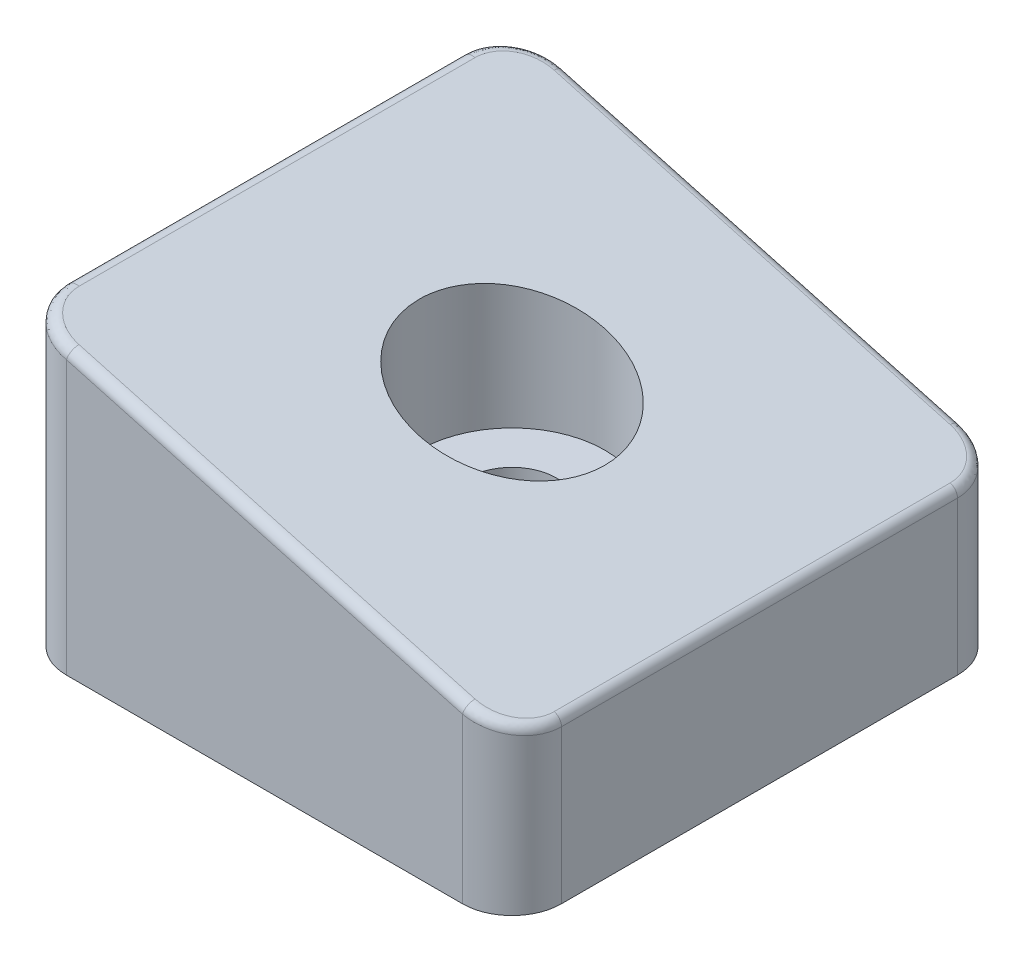
from build123d import *

# Parameters (mm, degrees)
BOSS_EXTRUDE1_DEPTH = 25.4
CUT_EXTRUDE1_DEPTH  = 44.994090512
CUT_EXTRUDE2_DEPTH  = 19.05
FILLET1_R           = 2.54
FILLET2_R           = 0.508


with BuildPart() as part:
    # Sketch1 → Boss-Extrude1 (new body)
    with BuildSketch(Plane.XY):
        Polygon((0, 27.94), (0, 12.7), (25.4, 12.7), (25.4, 20.955), align=None)
    extrude(amount=-BOSS_EXTRUDE1_DEPTH)

    # Sketch2 → Cut-Extrude1 (cut, through all)
    with BuildSketch(Plane(origin=(0, 38.1, 0), x_dir=(-1, 0, 0), z_dir=(0, -1, 0))):
        with BuildLine():
            ThreePointArc((-10.414, 12.7), (-11.825185674, 14.811988611), (-14.316446102, 14.316446102))
            Line((-14.316446102, 14.316446102), (-11.083553898, 11.083553898))
            ThreePointArc((-11.083553898, 11.083553898), (-10.588011389, 11.825185674), (-10.414, 12.7))
        make_face()
        with BuildLine():
            Line((-11.083553898, 11.083553898), (-14.316446102, 14.316446102))
            ThreePointArc((-14.316446102, 14.316446102), (-14.316446102, 11.083553898), (-11.083553898, 11.083553898))
        make_face()
    extrude(amount=CUT_EXTRUDE1_DEPTH, mode=Mode.SUBTRACT)

    # Sketch2<3> → Cut-Extrude2 (cut)
    with BuildSketch(Plane(origin=(0, 38.1, 0), x_dir=(-1, 0, 0), z_dir=(0, -1, 0))):
        with BuildLine():
            ThreePointArc((-7.9375, 12.7), (-10.877470153, 17.099976274), (-16.067596045, 16.067596045))
            Line((-16.067596045, 16.067596045), (-14.316446102, 14.316446102))
            ThreePointArc((-14.316446102, 14.316446102), (-11.825185674, 14.811988611), (-10.414, 12.7))
            ThreePointArc((-10.414, 12.7), (-10.588011389, 11.825185674), (-11.083553898, 11.083553898))
            Line((-11.083553898, 11.083553898), (-9.332403955, 9.332403955))
            ThreePointArc((-9.332403955, 9.332403955), (-8.300023726, 10.877470153), (-7.9375, 12.7))
        make_face()
        with BuildLine():
            Line((-14.316446102, 14.316446102), (-16.067596045, 16.067596045))
            ThreePointArc((-16.067596045, 16.067596045), (-16.067596045, 9.332403955), (-9.332403955, 9.332403955))
            Line((-9.332403955, 9.332403955), (-11.083553898, 11.083553898))
            ThreePointArc((-11.083553898, 11.083553898), (-14.316446102, 11.083553898), (-14.316446102, 14.316446102))
        make_face()
    extrude(amount=CUT_EXTRUDE2_DEPTH, mode=Mode.SUBTRACT)

    # Fillet1
    fillet1_edges = [part.edges().sort_by_distance(p)[0] for p in [
        (25.4, 16.8275, -25.4),
        (25.4, 16.8275, 0),
        (0, 20.32, 0),
        (0, 20.32, -25.4),
    ]]
    fillet(fillet1_edges, radius=FILLET1_R)

    # Fillet2
    fillet2_edges = [part.edges().sort_by_distance(p)[0] for p in [
        (12.7, 24.4475, 0),
        (0, 27.94, -12.7),
        (25.4, 20.955, -12.7),
        (12.7, 24.4475, -25.4),
        (24.639618159, 21.164105006, -0.727664709),
        (24.639618159, 21.164105006, -24.672335291),
        (0.760381841, 27.730894994, -24.672335291),
        (0.760381841, 27.730894994, -0.727664709),
    ]]
    fillet(fillet2_edges, radius=FILLET2_R)


solid = part.part
